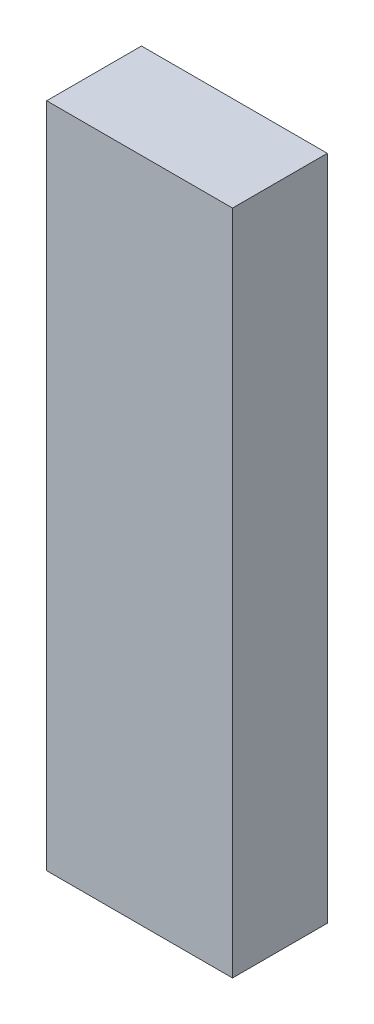
from build123d import *

# Parameters (mm, degrees)
SKICA1_W                = 4.9
SKICA1_H                = 17.58
P_IDAT_VYSUNUT_M1_DEPTH = 2.5


with BuildPart() as part:
    # Skica1 → Přidat vysunutím1 (new body)
    with BuildSketch(Plane.XY):
        Rectangle(SKICA1_W, SKICA1_H)
    extrude(amount=P_IDAT_VYSUNUT_M1_DEPTH)


solid = part.part
